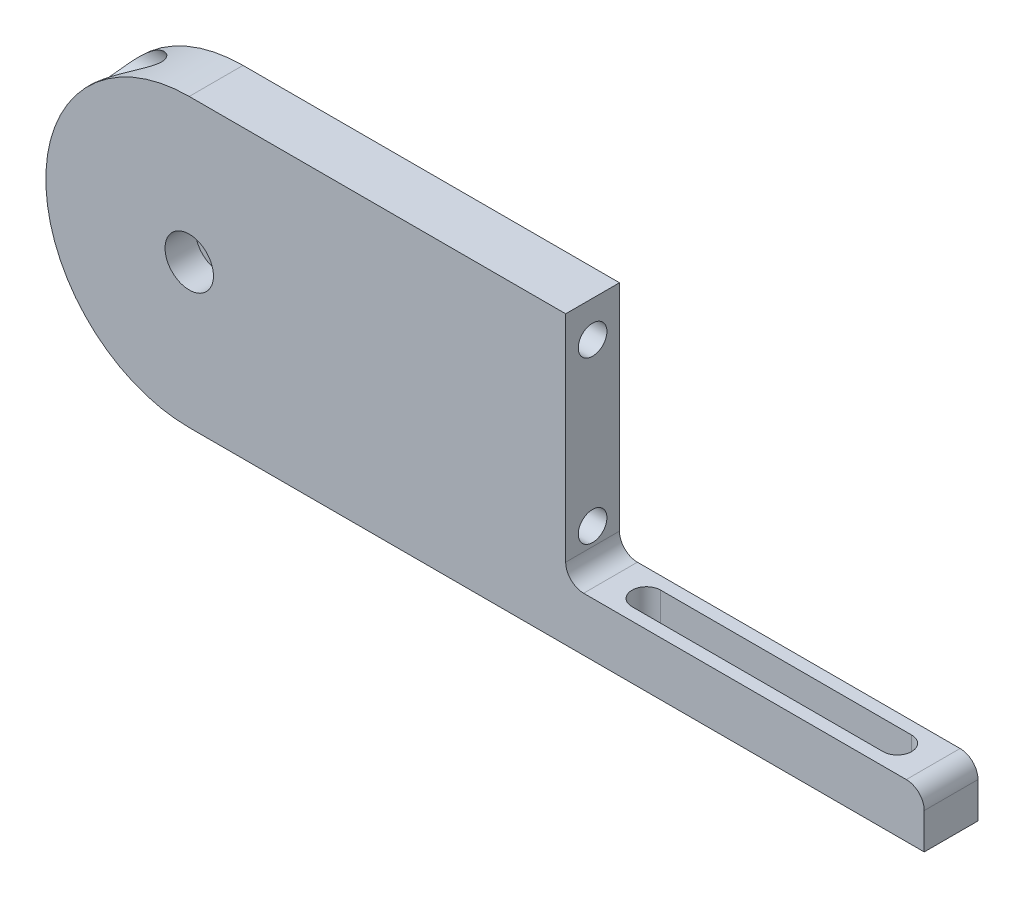
from build123d import *

# Parameters (mm, degrees)
ESTRUSIONE1_DEPTH        = 7.5
SCHIZZO2_R               = 4
TAGLIO_ESTRUSIONE1_DEPTH = 15
SCHIZZO4_R               = 6.75
TAGLIO_ESTRUSIONE3_DEPTH = 8.5
SCHIZZO11_W              = 15
SCHIZZO11_H              = 15
ESTRUSIONE3_DEPTH        = 100
RACCORDO2_R              = 5
SCHIZZO13_R              = 4
TAGLIO_ESTRUSIONE4_DEPTH = 151.602954818
SCHIZZO14_R              = 7
TAGLIO_ESTRUSIONE5_DEPTH = 132.458168383
TAGLIO_ESTRUSIONE6_DEPTH = 100


with BuildPart() as part:
    # Schizzo1 → Estrusione1 (new, symmetric)
    with BuildSketch(Plane.XY):
        with BuildLine():
            Line((0, 40), (105, 40))
            Line((105, 40), (105, -40))
            Line((105, -40), (0, -40))
            ThreePointArc((0, -40), (-40, 0), (0, 40))
        make_face()
    extrude(amount=ESTRUSIONE1_DEPTH, both=True)

    # Schizzo2 → Taglio-Estrusione1 (cut)
    with BuildSketch(Plane.XY.offset(7.5)):
        Circle(SCHIZZO2_R)
    extrude(amount=-TAGLIO_ESTRUSIONE1_DEPTH, mode=Mode.SUBTRACT)

    # Schizzo4 → Taglio-Estrusione3 (cut)
    with BuildSketch(Plane.XY.offset(7.5)):
        Circle(SCHIZZO4_R)
    extrude(amount=-TAGLIO_ESTRUSIONE3_DEPTH, mode=Mode.SUBTRACT)

    # Schizzo11 → Estrusione3 (add)
    with BuildSketch(Plane(origin=(105, 0, 0), x_dir=(0, 0, -1), z_dir=(1, 0, 0))):
        with Locations((0, -32.5)):
            Rectangle(SCHIZZO11_W, SCHIZZO11_H)
    extrude(amount=ESTRUSIONE3_DEPTH)

    # Raccordo2
    raccordo2_edges = [part.edges().sort_by_distance(p)[0] for p in [
        (105, -25, 0),
        (205, -25, 0),
    ]]
    fillet(raccordo2_edges, radius=RACCORDO2_R)

    # Schizzo13 → Taglio-Estrusione4 (cut, through all)
    with BuildSketch(Plane(origin=(105, 0, 0), x_dir=(0, 0, -1), z_dir=(1, 0, 0))):
        with Locations((0, -15)):
            Circle(SCHIZZO13_R)
        with Locations((0, 30)):
            Circle(SCHIZZO13_R)
    extrude(amount=-TAGLIO_ESTRUSIONE4_DEPTH, mode=Mode.SUBTRACT)

    # Schizzo14 → Taglio-Estrusione5 (cut, through all)
    with BuildSketch(Plane(origin=(85, 0, 0), x_dir=(0, 0, -1), z_dir=(1, 0, 0))):
        with Locations((0, 30)):
            Circle(SCHIZZO14_R)
        with Locations((0, -15)):
            Circle(SCHIZZO14_R)
    extrude(amount=-TAGLIO_ESTRUSIONE5_DEPTH, mode=Mode.SUBTRACT)

    # Schizzo15 → Taglio-Estrusione6 (cut)
    with BuildSketch(Plane.XZ.offset(40)):
        with BuildLine():
            Line((120, 4), (190, 4))
            ThreePointArc((190, 4), (194, 0), (190, -4))
            Line((190, -4), (120, -4))
            ThreePointArc((120, -4), (116, 0), (120, 4))
        make_face()
    extrude(amount=-TAGLIO_ESTRUSIONE6_DEPTH, mode=Mode.SUBTRACT)


solid = part.part
